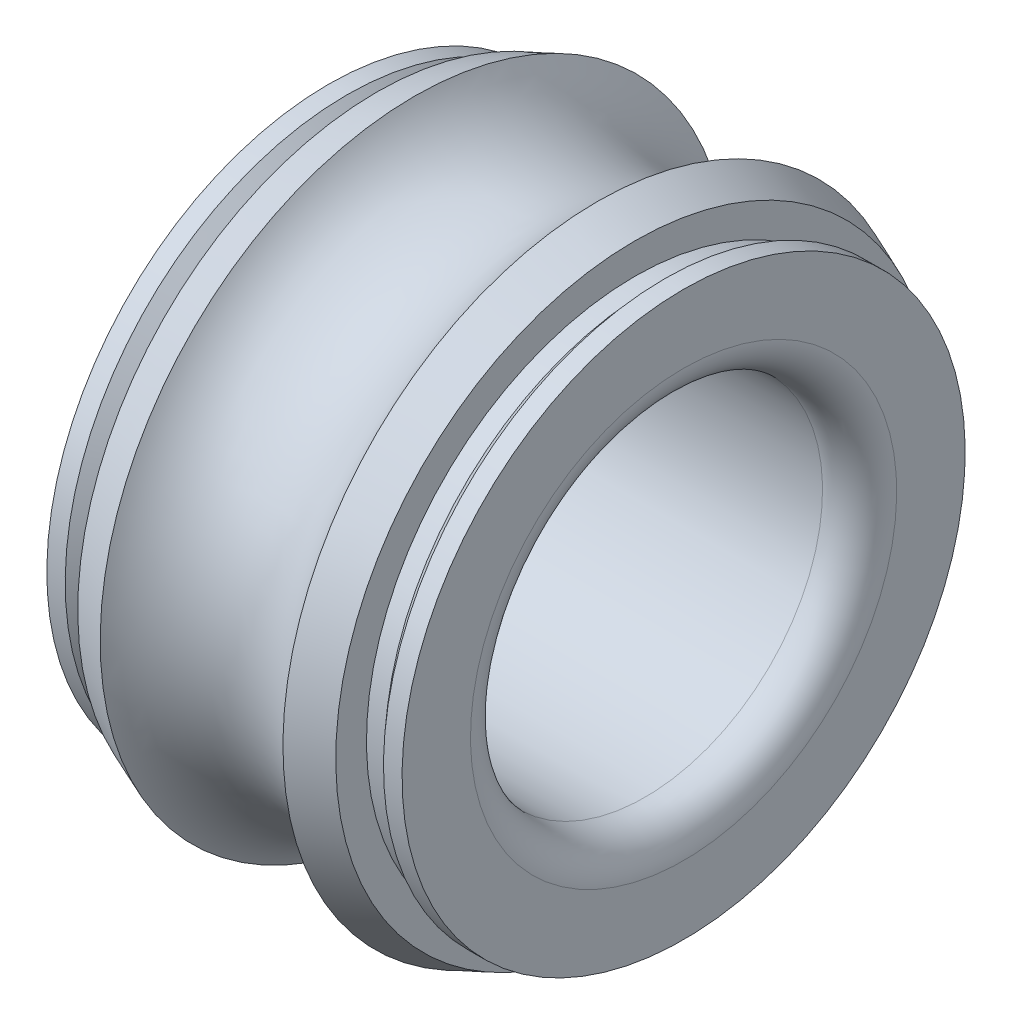
from build123d import *


with BuildPart() as part:
    # Esboço1 → Revolução1 (revolve)
    with BuildSketch(Plane.XY):
        with BuildLine():
            Line((-1.987746966, 2.501488878), (1.957031844, 2.501488878))
            ThreePointArc((1.957031844, 2.501488878), (2.338841632, 2.631957255), (2.5, 3.001860882))
            Line((2.5, 3.001860882), (2.5, 3.965053738))
            Line((2.5, 3.965053738), (2.23843243, 3.965053738))
            Line((2.23843243, 3.965053738), (2.073164994, 3.780299443))
            Line((2.073164994, 3.780299443), (1.814623731, 3.780299443))
            Line((1.814623731, 3.780299443), (1.814623731, 4.212372284))
            Line((1.814623731, 4.212372284), (1.285147612, 4.426320864))
            ThreePointArc((1.285147612, 4.426320864), (0, 3.699881214), (-1.285147612, 4.426320864))
            Line((-1.285147612, 4.426320864), (-1.814623731, 4.212372284))
            Line((-1.814623731, 4.212372284), (-1.814623731, 3.780299443))
            Line((-1.814623731, 3.780299443), (-2.073164994, 3.780299443))
            Line((-2.073164994, 3.780299443), (-2.23843243, 3.965053738))
            Line((-2.23843243, 3.965053738), (-2.496862345, 3.965053738))
            Line((-2.496862345, 3.965053738), (-2.496862345, 3.001860882))
            ThreePointArc((-2.496862345, 3.001860882), (-2.347340579, 2.644803585), (-1.987746966, 2.501488878))
        make_face()
    revolve(axis=Axis((0, 0.001488878, 0), (-0.9999999196990055, -0.000400751771926105, 0)))


solid = part.part
